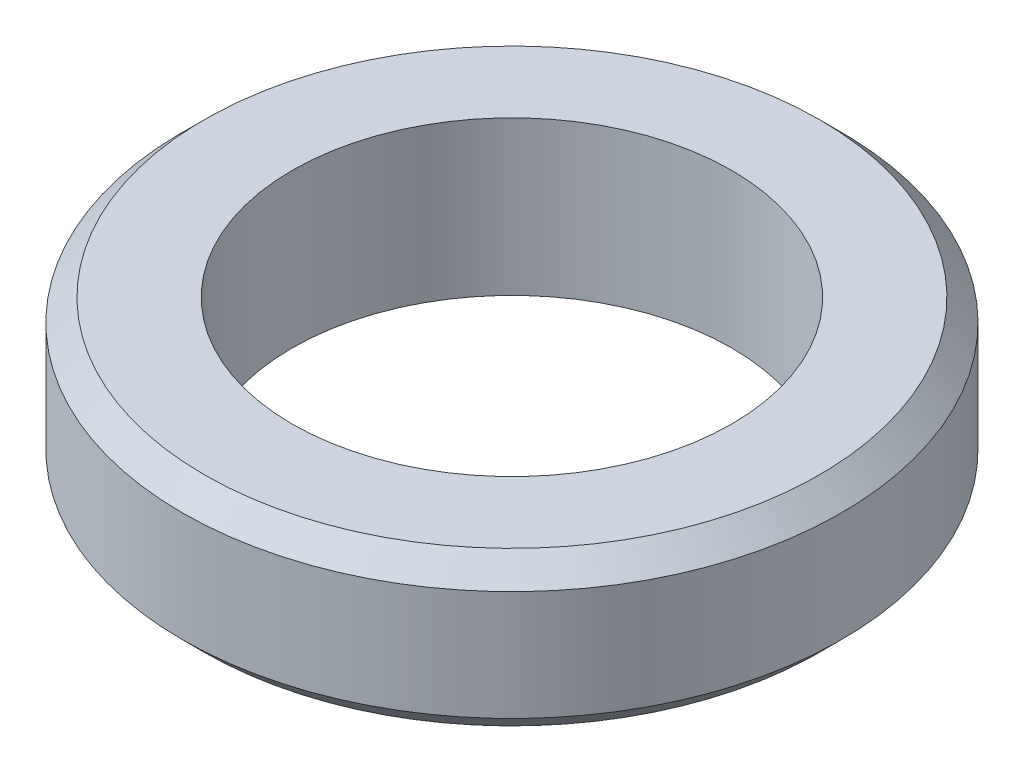
from build123d import *

# Parameters (mm, degrees)
SKETCH1_R            = 7.5
SKETCH1_R_2          = 5
CORPO_15_3_5_DEPTH   = 3.5
CHANFROS_0_5_45_SIZE = 0.5


with BuildPart() as part:
    # Sketch1 → Corpo Ø15×3.5 (new body)
    with BuildSketch(Plane(origin=(0, 0, 0), x_dir=(1, 0, 0), z_dir=(0, 1, 0))):
        with Locations(Location((0, 0, 0), (0, 0, 270))):
            Circle(SKETCH1_R)
        with Locations(Location((0, 0, 0), (0, 0, 270))):
            Circle(SKETCH1_R_2, mode=Mode.SUBTRACT)
    extrude(amount=CORPO_15_3_5_DEPTH)

    # Chanfros 0.5×45°
    chanfros_0_5_45_edges = [part.edges().sort_by_distance(p)[0] for p in [
        (0, 0, -7.5),
        (0, 3.5, -7.5),
    ]]
    chamfer(chanfros_0_5_45_edges, length=CHANFROS_0_5_45_SIZE)


solid = part.part
